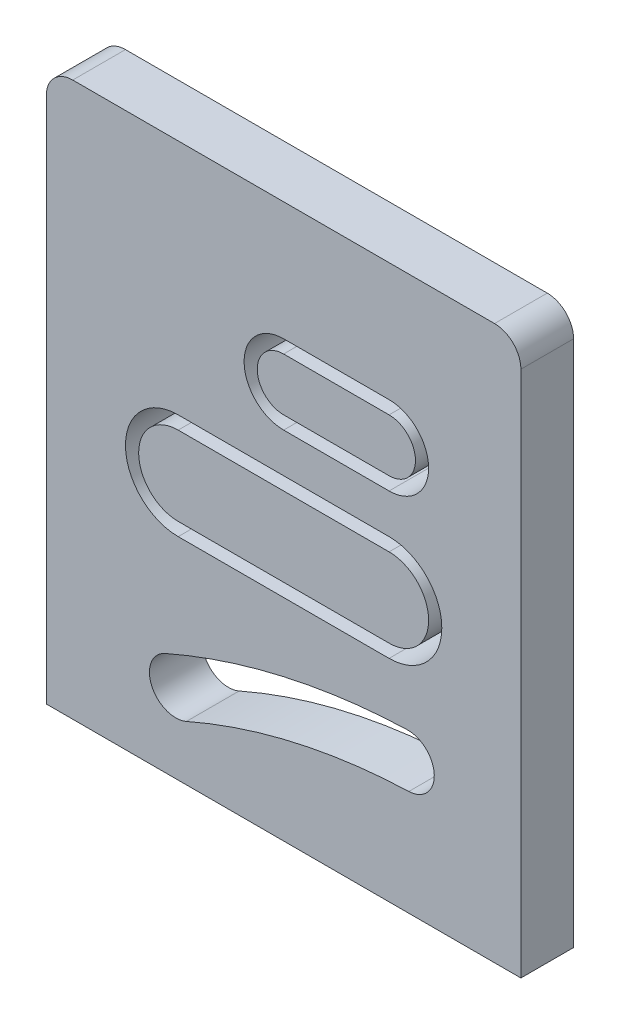
from build123d import *

# Parameters (mm, degrees)
EXTRUDE_10_DEPTH   = 20
EXTRUDE_10_2_DEPTH = 20
EXTRUDE_10_3_DEPTH = 20


with BuildPart() as part:
    # 草图1 → 凸台-拉伸10 (new body)
    with BuildSketch(Plane.XY):
        with BuildLine():
            Line((-479.064282439, 166.210178848), (-319.064282439, 166.210178848))
            ThreePointArc((-319.064282439, 166.210178848), (-311.993214627, 163.28124666), (-309.064282439, 156.210178848))
            Line((-309.064282439, 156.210178848), (-309.064282439, -43.789821152))
            Line((-309.064282439, -43.789821152), (-489.064282439, -43.789821152))
            Line((-489.064282439, -43.789821152), (-489.064282439, 156.210178848))
            ThreePointArc((-489.064282439, 156.210178848), (-486.135350251, 163.28124666), (-479.064282439, 166.210178848))
        make_face()
        with BuildLine():
            ThreePointArc((-444.000712398, -4.636250166), (-449.127853425, -17.81625111), (-435.947852481, -22.943392137))
            ThreePointArc((-435.947852481, -22.943392137), (-394.691102087, -9.322850403), (-351.598568154, -3.784607956))
            ThreePointArc((-351.598568154, -3.784607956), (-341.926638492, 6.533035991), (-352.244282439, 16.204965653))
            ThreePointArc((-352.244282439, 16.204965653), (-399.120993998, 10.180381577), (-444.000712398, -4.636250166))
        make_face(mode=Mode.SUBTRACT)
        with BuildLine():
            ThreePointArc((-359.064282439, 36.210178848), (-339.064282439, 56.210178848), (-359.064282439, 76.210178848))
            Line((-359.064282439, 76.210178848), (-439.064282439, 76.210178848))
            ThreePointArc((-439.064282439, 76.210178848), (-459.064282439, 56.210178848), (-439.064282439, 36.210178848))
            Line((-439.064282439, 36.210178848), (-359.064282439, 36.210178848))
        make_face(mode=Mode.SUBTRACT)
        with BuildLine():
            ThreePointArc((-359.064282439, 91.210178848), (-344.064282439, 106.210178848), (-359.064282439, 121.210178848))
            Line((-359.064282439, 121.210178848), (-399.064282439, 121.210178848))
            ThreePointArc((-399.064282439, 121.210178848), (-414.064282439, 106.210178848), (-399.064282439, 91.210178848))
            Line((-399.064282439, 91.210178848), (-359.064282439, 91.210178848))
        make_face(mode=Mode.SUBTRACT)
    extrude(amount=EXTRUDE_10_DEPTH)


with BuildPart() as body_2:
    # 草图1 → Extrude 10 2 (new body)
    with BuildSketch(Plane.XY):
        with BuildLine():
            Line((-399.064282439, 116.210178848), (-359.064282439, 116.210178848))
            ThreePointArc((-359.064282439, 116.210178848), (-349.064282439, 106.210178848), (-359.064282439, 96.210178848))
            Line((-359.064282439, 96.210178848), (-399.064282439, 96.210178848))
            ThreePointArc((-399.064282439, 96.210178848), (-409.064282439, 106.210178848), (-399.064282439, 116.210178848))
        make_face()
    extrude(amount=EXTRUDE_10_2_DEPTH)


with BuildPart() as body_3:
    # 草图1 → Extrude 10 3 (new body)
    with BuildSketch(Plane.XY):
        with BuildLine():
            Line((-439.064282439, 71.210178848), (-359.064282439, 71.210178848))
            ThreePointArc((-359.064282439, 71.210178848), (-344.064282439, 56.210178848), (-359.064282439, 41.210178848))
            Line((-359.064282439, 41.210178848), (-439.064282439, 41.210178848))
            ThreePointArc((-439.064282439, 41.210178848), (-454.064282439, 56.210178848), (-439.064282439, 71.210178848))
        make_face()
    extrude(amount=EXTRUDE_10_3_DEPTH)


solid = Compound([part.part, body_2.part, body_3.part])
